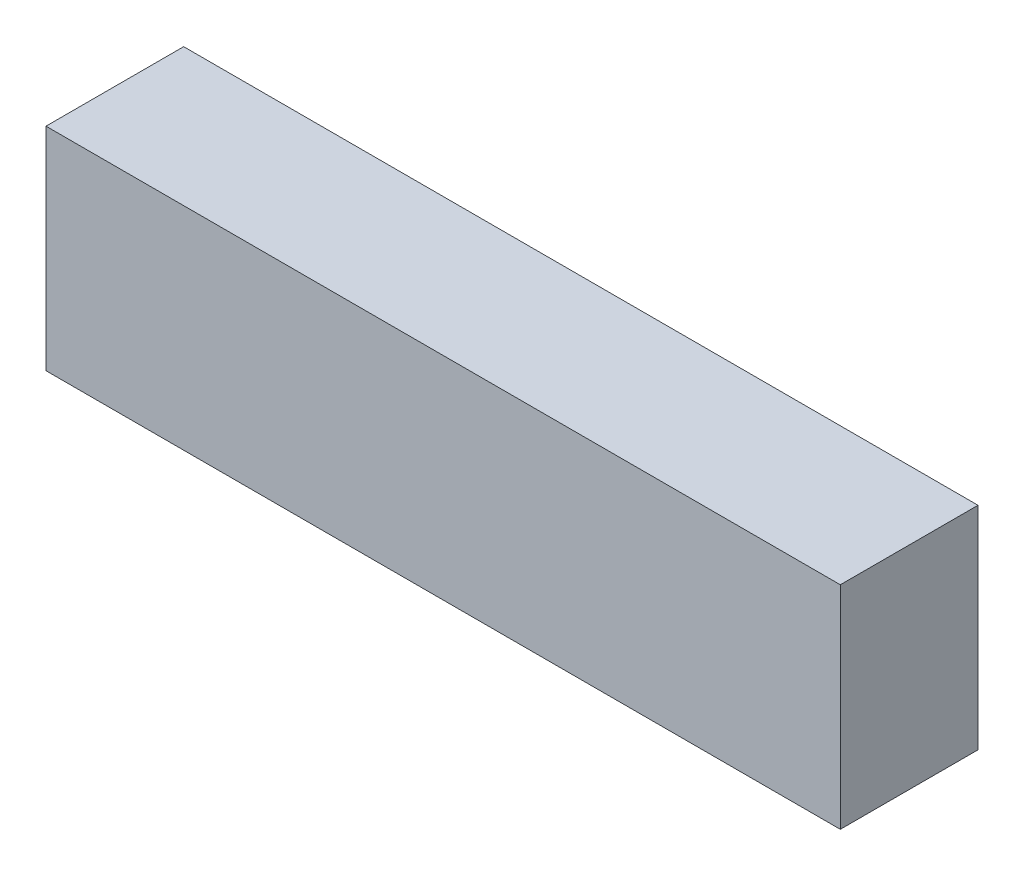
from build123d import *

# Parameters (mm, degrees)
SKETCH_1_W      = 75
SKETCH_1_H      = 20
EXTRUDE_1_DEPTH = 13


with BuildPart() as part:
    # Эскиз1 → Бобышка-Вытянуть1 (new body)
    with BuildSketch(Plane.XY):
        Rectangle(SKETCH_1_W, SKETCH_1_H)
    extrude(amount=EXTRUDE_1_DEPTH)


solid = part.part
